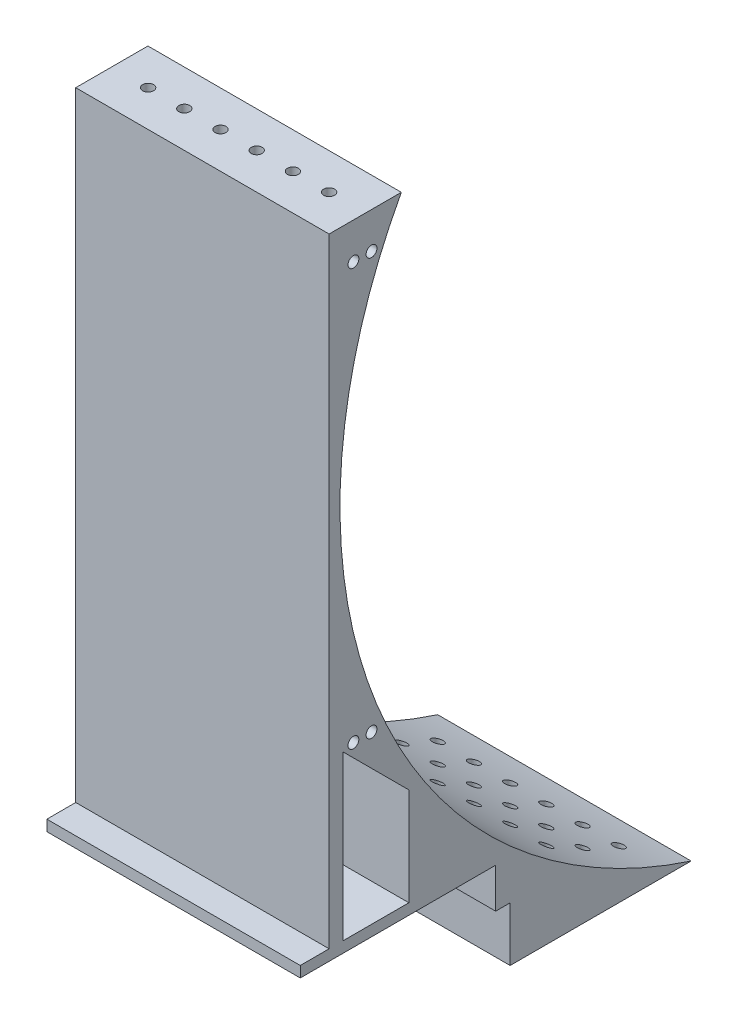
from build123d import *

# Parameters (mm, degrees)
BOSS_EXTRUDE1_DEPTH = 70
CUT_EXTRUDE2_DEPTH  = 235.307490277
SKETCH6_W           = 70
SKETCH6_H           = 3
BOSS_EXTRUDE2_DEPTH = 30
SKETCH7_R           = 1.5
CUT_EXTRUDE3_DEPTH  = 20
SKETCH8_R           = 1.5
CUT_EXTRUDE4_DEPTH  = 15
SKETCH9_R           = 1.5
CUT_EXTRUDE5_DEPTH  = 20
SKETCH10_R          = 1.5
CUT_EXTRUDE6_DEPTH  = 235.307490435


with BuildPart() as part:
    # Sketch1 → Boss-Extrude1 (new body)
    with BuildSketch(Plane(origin=(0, 0, 0), x_dir=(0, 0, -1), z_dir=(1, 0, 0))):
        with BuildLine():
            Line((0, 200), (0, 0))
            Line((0, 0), (100, 0))
            ThreePointArc((100, 0), (13.025244547, 81.208240961), (19.946550109, 200))
            Line((19.946550109, 200), (0, 200))
        make_face()
    extrude(amount=BOSS_EXTRUDE1_DEPTH)

    # Sketch5 → Cut-Extrude2 (cut, through all)
    with BuildSketch(Plane(origin=(70, 0, 0), x_dir=(0, 0, -1), z_dir=(1, 0, 0))):
        Polygon((22.027296405, 26), (22.027296405, 56), (3.858869779, 74.168426626), (3.858869779, 26), (0, 26), (0, 0), (50, 0), (50, 15), (46, 15), (46, 26), align=None)
    extrude(amount=-CUT_EXTRUDE2_DEPTH, mode=Mode.SUBTRACT)

    # Sketch6 → Boss-Extrude2 (add)
    with BuildSketch(Plane.XY.offset(-22.027296405)):
        with Locations((35, 27.5)):
            Rectangle(SKETCH6_W, SKETCH6_H)
    extrude(amount=BOSS_EXTRUDE2_DEPTH)

    # Sketch7 → Cut-Extrude3 (cut)
    with BuildSketch(Plane(origin=(0, 200, 0), x_dir=(1, 0, 0), z_dir=(0, 1, 0))):
        with Locations(Location((10, 10, 0), (0, 0, 270))):
            Circle(SKETCH7_R)
        with Locations(Location((20, 10, 0), (0, 0, 270))):
            Circle(SKETCH7_R)
        with Locations(Location((30, 10, 0), (0, 0, 270))):
            Circle(SKETCH7_R)
        with Locations(Location((40, 10, 0), (0, 0, 270))):
            Circle(SKETCH7_R)
        with Locations(Location((50, 10, 0), (0, 0, 270))):
            Circle(SKETCH7_R)
        with Locations(Location((60, 10, 0), (0, 0, 270))):
            Circle(SKETCH7_R)
    extrude(amount=-CUT_EXTRUDE3_DEPTH, mode=Mode.SUBTRACT)

    # Sketch8 → Cut-Extrude4 (cut)
    with BuildSketch(Plane.XZ):
        with Locations(Location((10, -90, 0), (0, 0, 270))):
            Circle(SKETCH8_R)
        with Locations(Location((20, -90, 0), (0, 0, 270))):
            Circle(SKETCH8_R)
        with Locations(Location((30, -90, 0), (0, 0, 270))):
            Circle(SKETCH8_R)
        with Locations(Location((40, -90, 0), (0, 0, 270))):
            Circle(SKETCH8_R)
        with Locations(Location((50, -90, 0), (0, 0, 270))):
            Circle(SKETCH8_R)
        with Locations(Location((60, -90, 0), (0, 0, 270))):
            Circle(SKETCH8_R)
        with Locations(Location((20, -80, 0), (0, 0, 270))):
            Circle(SKETCH8_R)
        with Locations(Location((30, -80, 0), (0, 0, 270))):
            Circle(SKETCH8_R)
        with Locations(Location((40, -80, 0), (0, 0, 270))):
            Circle(SKETCH8_R)
        with Locations(Location((50, -80, 0), (0, 0, 270))):
            Circle(SKETCH8_R)
        with Locations(Location((60, -80, 0), (0, 0, 270))):
            Circle(SKETCH8_R)
        with Locations(Location((20, -70, 0), (0, 0, 270))):
            Circle(SKETCH8_R)
        with Locations(Location((30, -70, 0), (0, 0, 270))):
            Circle(SKETCH8_R)
        with Locations(Location((40, -70, 0), (0, 0, 270))):
            Circle(SKETCH8_R)
        with Locations(Location((50, -70, 0), (0, 0, 270))):
            Circle(SKETCH8_R)
        with Locations(Location((60, -70, 0), (0, 0, 270))):
            Circle(SKETCH8_R)
        with Locations(Location((20, -60, 0), (0, 0, 270))):
            Circle(SKETCH8_R)
        with Locations(Location((30, -60, 0), (0, 0, 270))):
            Circle(SKETCH8_R)
        with Locations(Location((40, -60, 0), (0, 0, 270))):
            Circle(SKETCH8_R)
        with Locations(Location((50, -60, 0), (0, 0, 270))):
            Circle(SKETCH8_R)
        with Locations(Location((60, -60, 0), (0, 0, 270))):
            Circle(SKETCH8_R)
        with Locations(Location((10, -80, 0), (0, 0, 270))):
            Circle(SKETCH8_R)
        with Locations(Location((10, -70, 0), (0, 0, 270))):
            Circle(SKETCH8_R)
        with Locations(Location((10, -60, 0), (0, 0, 270))):
            Circle(SKETCH8_R)
    extrude(amount=-CUT_EXTRUDE4_DEPTH, mode=Mode.SUBTRACT)

    # Sketch9 → Cut-Extrude5 (cut)
    with BuildSketch(Plane.XZ.offset(-26)):
        with Locations(Location((20, -6, 0), (0, 0, 270))):
            Circle(SKETCH9_R)
        with Locations(Location((20, -31, 0), (0, 0, 270))):
            Circle(SKETCH9_R)
        with Locations(Location((50, -31, 0), (0, 0, 90))):
            Circle(SKETCH9_R)
        with Locations(Location((50, -6, 0), (0, 0, 270))):
            Circle(SKETCH9_R)
    extrude(amount=-CUT_EXTRUDE5_DEPTH, mode=Mode.SUBTRACT)

    # Sketch10 → Cut-Extrude6 (cut, through all)
    with BuildSketch(Plane(origin=(70, 0, 0), x_dir=(0, 0, -1), z_dir=(1, 0, 0))):
        with Locations((6.71, 75)):
            Circle(SKETCH10_R)
        with Locations((11.71, 75)):
            Circle(SKETCH10_R)
        with Locations((6.71, 190)):
            Circle(SKETCH10_R)
        with Locations((11.71, 190)):
            Circle(SKETCH10_R)
    extrude(amount=-CUT_EXTRUDE6_DEPTH, mode=Mode.SUBTRACT)


solid = part.part
